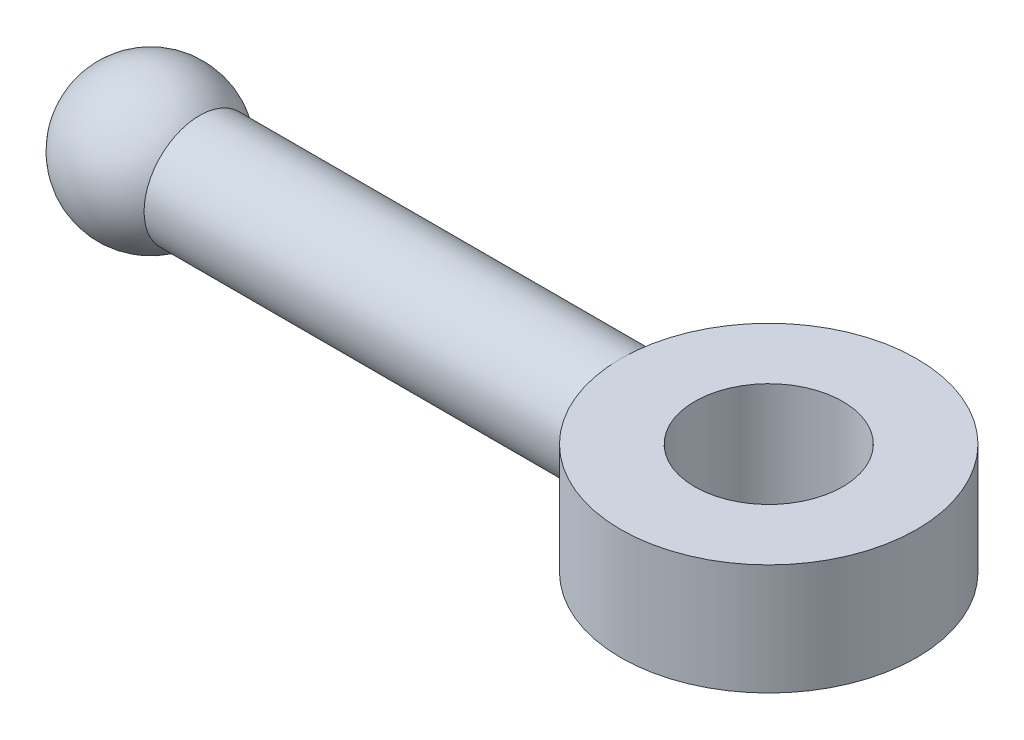
from build123d import *

# Parameters (mm, degrees)
SKETCH1_R           = 15
BOSS_EXTRUDE1_DEPTH = 130
SKETCH7_R           = 40
SKETCH7_R_2         = 20
BOSS_EXTRUDE2_DEPTH = 15


with BuildPart() as part:
    # Sketch1 → Boss-Extrude1 (new body)
    with BuildSketch(Plane(origin=(0, 0, 0), x_dir=(0, 0, -1), z_dir=(1, 0, 0))):
        Circle(SKETCH1_R)
    extrude(amount=BOSS_EXTRUDE1_DEPTH)

    # Sketch4 → Revolve1 (revolve)
    with BuildSketch(Plane.XY):
        with BuildLine():
            Line((-20, 0), (20, 0))
            ThreePointArc((20, 0), (0, 20), (-20, 0))
        make_face()
    revolve(axis=Axis((0, 0, 0), (1, 0, 0)))

    # Sketch7 → Boss-Extrude2 (add, symmetric)
    with BuildSketch(Plane(origin=(0, 0, 0), x_dir=(1, 0, 0), z_dir=(0, 1, 0))):
        with Locations((167.080992435, 0)):
            Circle(SKETCH7_R)
        with Locations(Location((167.080992435, 0, 0), (0, 0, 270))):
            Circle(SKETCH7_R_2, mode=Mode.SUBTRACT)
    extrude(amount=BOSS_EXTRUDE2_DEPTH, both=True)


solid = part.part
